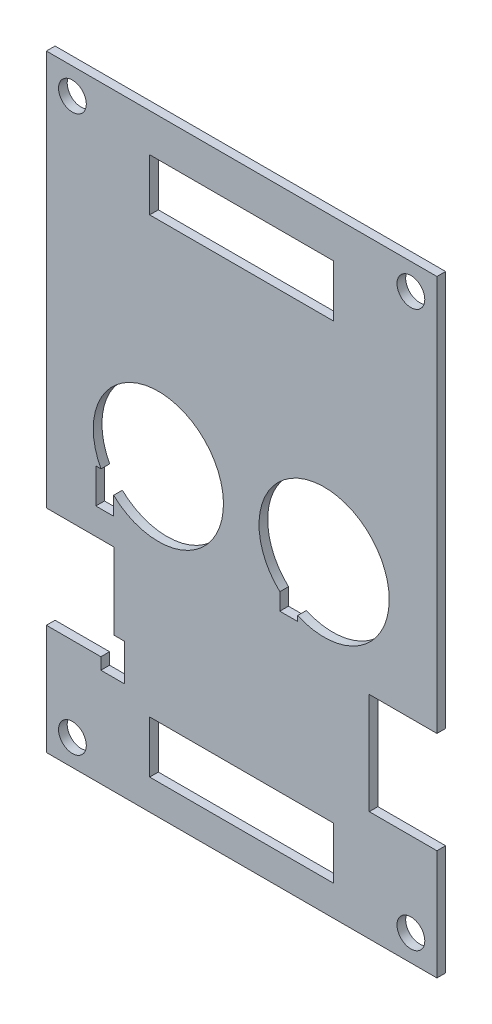
from build123d import *

# Parameters (mm, degrees)
SKETCH1_R           = 1.6
BOSS_EXTRUDE1_DEPTH = 1
SKETCH5_W           = 2.05
SKETCH5_H           = 4
CUT_EXTRUDE1_DEPTH  = 4
SKETCH4_W           = 21.2
SKETCH4_H           = 6
CUT_EXTRUDE2_DEPTH  = 4
SKETCH2_R           = 7.5
CUT_EXTRUDE3_DEPTH  = 4


with BuildPart() as part:
    # Sketch1 → Boss-Extrude1 (new body)
    with BuildSketch(Plane.XY):
        Polygon((20.734205703, -15.283501687), (20.734205703, -27.983501687), (-24.265794297, -27.983501687), (-24.265794297, -15.283501687), (-17.985794297, -15.283501687), (-17.985794297, -16.633501687), (-15.265794297, -16.633501687), (-15.265794297, -12.383501687), (-16.465794297, -12.383501687), (-16.465794297, -3.583501687), (-24.265794297, -3.583501687), (-24.265794297, 42.016498313), (20.734205703, 42.016498313), (20.734205703, -3.583501687), (12.934205703, -3.583501687), (12.934205703, -15.283501687), align=None)
        with Locations((-21.265794297, 39.016498313)):
            Circle(SKETCH1_R, mode=Mode.SUBTRACT)
        with Locations((17.734205703, 39.016498313)):
            Circle(SKETCH1_R, mode=Mode.SUBTRACT)
        with Locations((-21.265794297, -24.983501687)):
            Circle(SKETCH1_R, mode=Mode.SUBTRACT)
        with Locations((17.734205703, -24.983501687)):
            Circle(SKETCH1_R, mode=Mode.SUBTRACT)
    extrude(amount=BOSS_EXTRUDE1_DEPTH)

    # Sketch5 → Cut-Extrude1 (cut)
    with BuildSketch(Plane.XY.offset(1)):
        with Locations((-17.540794297, 1.466498313)):
            Rectangle(SKETCH5_W, SKETCH5_H)
        with Locations((3.659205703, 1.566498313)):
            Rectangle(SKETCH5_W, SKETCH5_H)
    extrude(amount=-CUT_EXTRUDE1_DEPTH, mode=Mode.SUBTRACT)

    # Sketch4 → Cut-Extrude2 (cut)
    with BuildSketch(Plane.XY.offset(1)):
        with Locations((-1.765794297, -21.483501687)):
            Rectangle(SKETCH4_W, SKETCH4_H)
        with Locations((-1.765794297, 34.616498313)):
            Rectangle(SKETCH4_W, SKETCH4_H)
    extrude(amount=-CUT_EXTRUDE2_DEPTH, mode=Mode.SUBTRACT)

    # Sketch2 → Cut-Extrude3 (cut)
    with BuildSketch(Plane.XY.offset(1)):
        with Locations((-11.365794297, 7.016498313)):
            Circle(SKETCH2_R)
        with Locations((7.734205703, 7.016498313)):
            Circle(SKETCH2_R)
    extrude(amount=-CUT_EXTRUDE3_DEPTH, mode=Mode.SUBTRACT)


solid = part.part
